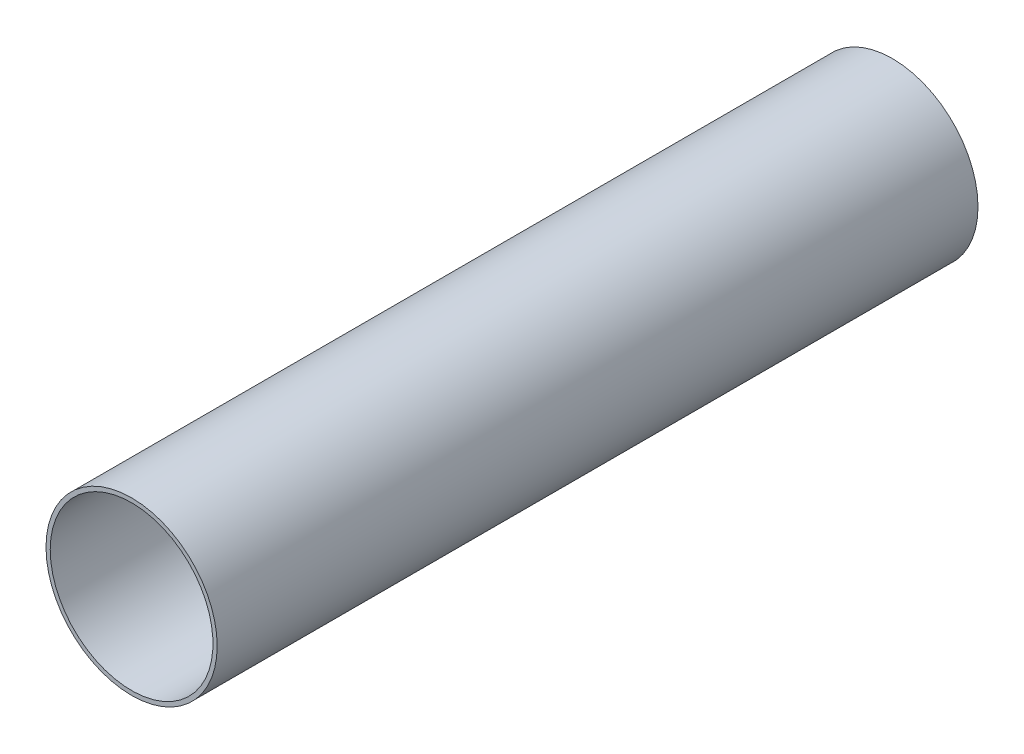
from build123d import *

# Parameters (mm, degrees)
SKETCH1_R           = 20.25
SKETCH1_R_2         = 19.25
BOSS_EXTRUDE1_DEPTH = 180


with BuildPart() as part:
    # Sketch1 → Boss-Extrude1 (new body)
    with BuildSketch(Plane.XY):
        with Locations(Location((0, 0, 0), (0, 0, 180))):
            Circle(SKETCH1_R)
        with Locations(Location((0, 0, 0), (0, 0, 180))):
            Circle(SKETCH1_R_2, mode=Mode.SUBTRACT)
    extrude(amount=BOSS_EXTRUDE1_DEPTH)


solid = part.part
